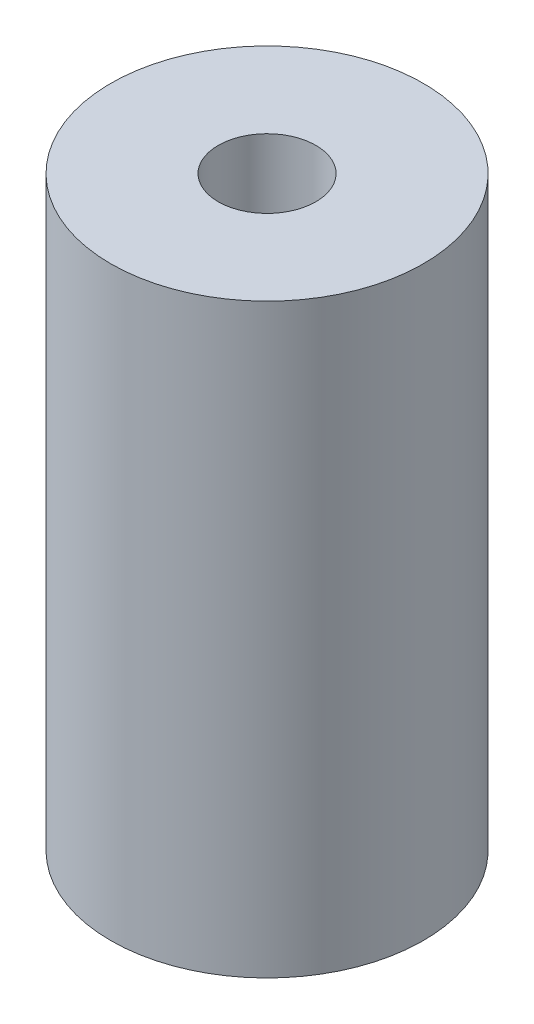
from build123d import *

# Parameters (mm, degrees)
SKETCHCYLINDER_R          = 1.6
SKETCHCYLINDER_R_2        = 0.5
BOSSEXTRUDECYLINDER_DEPTH = 6


with BuildPart() as part:
    # SketchCylinder → BossExtrudeCylinder (new body)
    with BuildSketch(Plane(origin=(0, 0, 0), x_dir=(1, 0, 0), z_dir=(0, 1, 0))):
        with Locations(Location((0, 0, 0), (0, 0, 270))):
            Circle(SKETCHCYLINDER_R)
        with Locations(Location((0, 0, 0), (0, 0, 270))):
            Circle(SKETCHCYLINDER_R_2, mode=Mode.SUBTRACT)
    extrude(amount=BOSSEXTRUDECYLINDER_DEPTH)


solid = part.part
